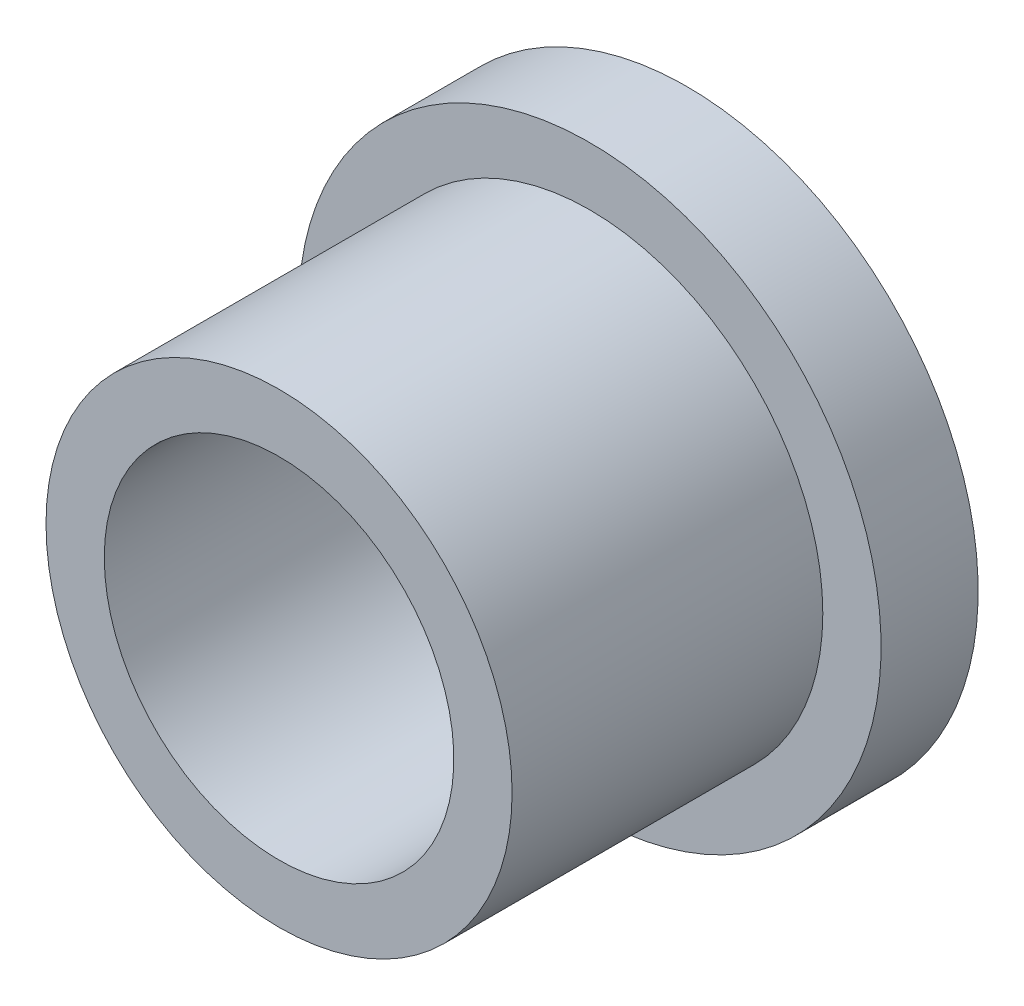
from build123d import *

# Parameters (mm, degrees)
SKETCH1_R           = 15
SKETCH1_R_2         = 12
BOSS_EXTRUDE1_DEPTH = 5
SKETCH1_3_R         = 12
SKETCH1_3_R_2       = 9
BOSS_EXTRUDE2_DEPTH = 21


with BuildPart() as part:
    # Sketch1 → Boss-Extrude1 (new body)
    with BuildSketch(Plane.XY):
        Circle(SKETCH1_R)
        Circle(SKETCH1_R_2, mode=Mode.SUBTRACT)
    extrude(amount=BOSS_EXTRUDE1_DEPTH)

    # Sketch1<3> → Boss-Extrude2 (add)
    with BuildSketch(Plane.XY):
        Circle(SKETCH1_3_R)
        Circle(SKETCH1_3_R_2, mode=Mode.SUBTRACT)
    extrude(amount=BOSS_EXTRUDE2_DEPTH)


solid = part.part
